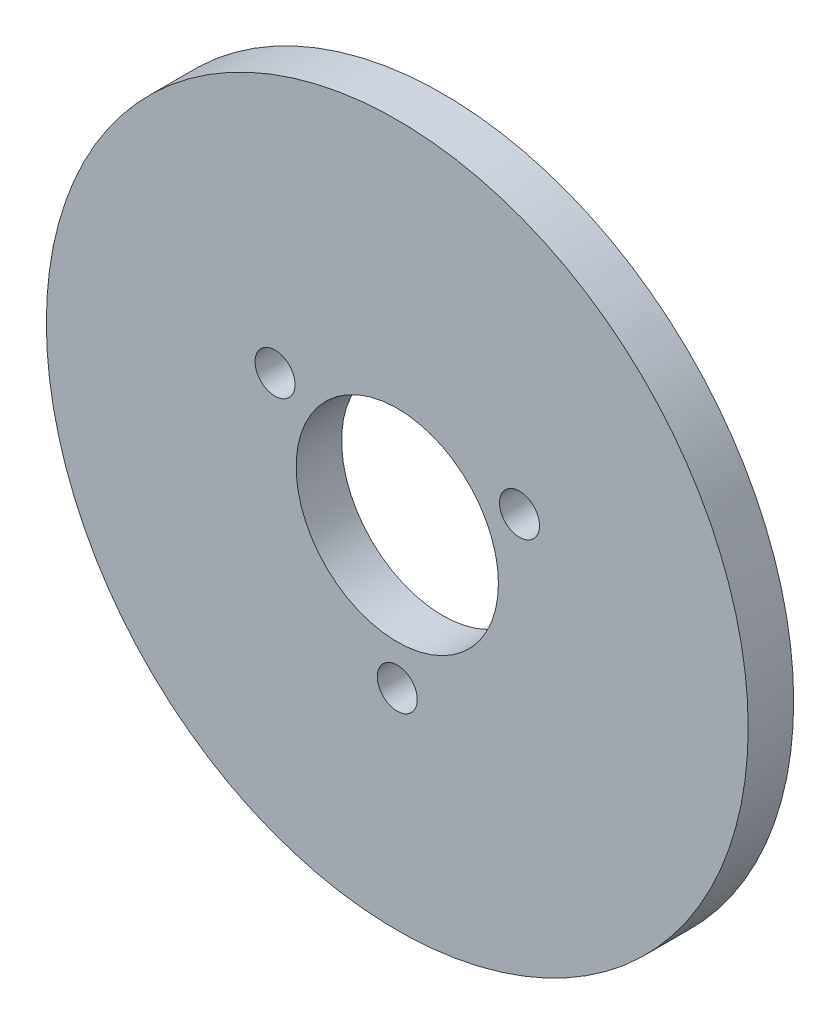
from build123d import *

# Parameters (mm, degrees)
SKETCH1_R           = 22.375
SKETCH1_R_2         = 6.45
BOSS_EXTRUDE1_DEPTH = 2.9
SKETCH2_R           = 1.275
CUT_EXTRUDE1_DEPTH  = 32.775639254


with BuildPart() as part:
    # Sketch1 → Boss-Extrude1 (new body)
    with BuildSketch(Plane.XY):
        Circle(SKETCH1_R)
        Circle(SKETCH1_R_2, mode=Mode.SUBTRACT)
    extrude(amount=BOSS_EXTRUDE1_DEPTH)

    # Sketch2 → Cut-Extrude1 (cut, through all)
    with BuildSketch(Plane(origin=(0, 0, 0), x_dir=(-1, 0, 0), z_dir=(0, 0, -1))):
        with Locations((7.794228634, 4.5)):
            Circle(SKETCH2_R)
        with Locations((-7.794228634, 4.5)):
            Circle(SKETCH2_R)
        with Locations((0, -9)):
            Circle(SKETCH2_R)
    extrude(amount=-CUT_EXTRUDE1_DEPTH, mode=Mode.SUBTRACT)


solid = part.part
